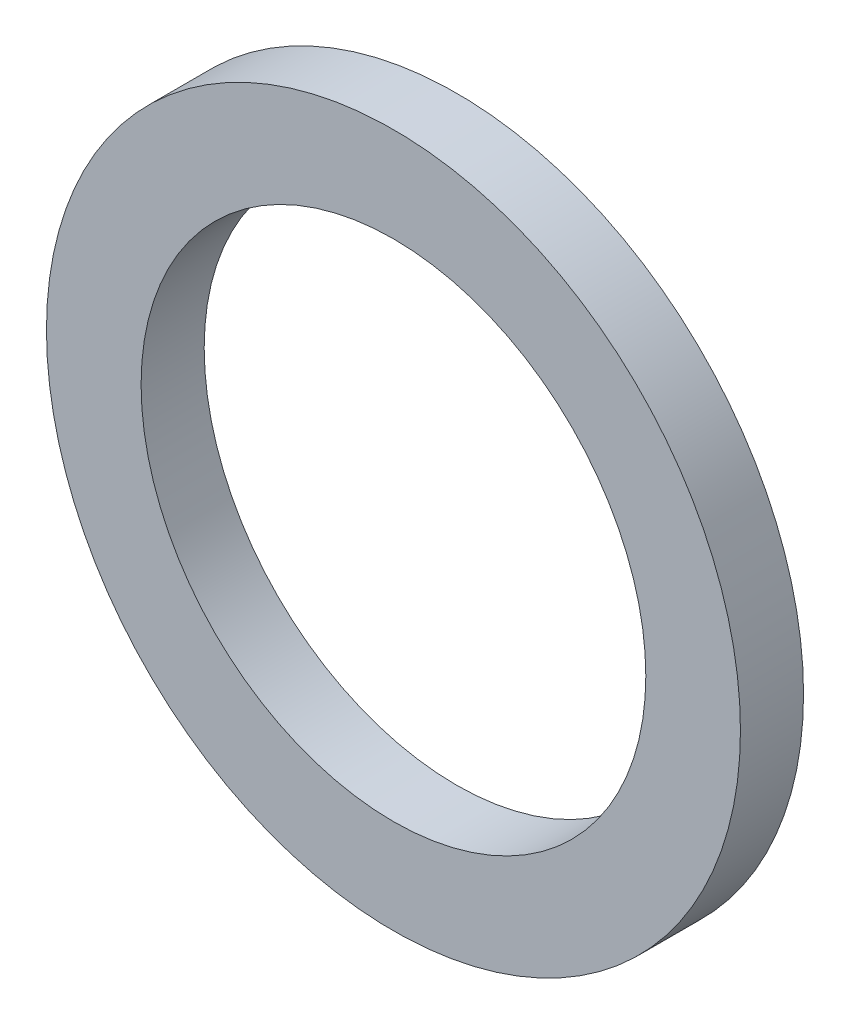
from build123d import *

# Parameters (mm, degrees)
SKETCH1_R           = 11
SKETCH1_R_2         = 8
BOSS_EXTRUDE1_DEPTH = 2


with BuildPart() as part:
    # Sketch1 → Boss-Extrude1 (new body)
    with BuildSketch(Plane.XY):
        Circle(SKETCH1_R)
        Circle(SKETCH1_R_2, mode=Mode.SUBTRACT)
    extrude(amount=BOSS_EXTRUDE1_DEPTH)


solid = part.part
